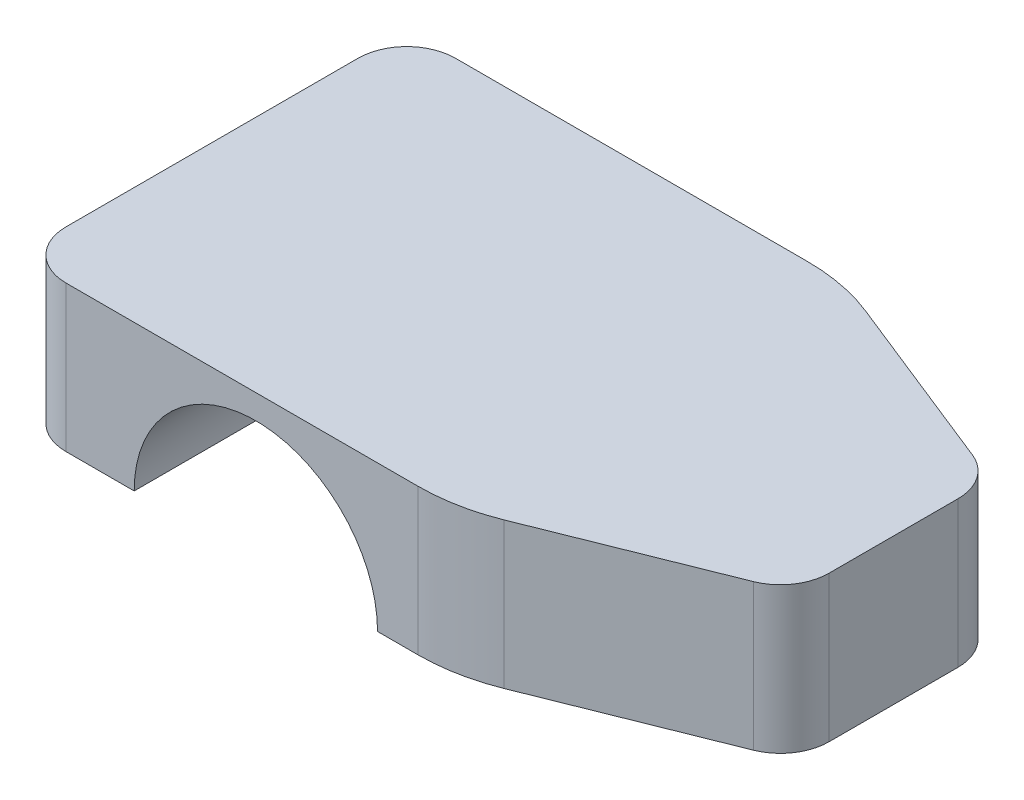
from build123d import *

# Parameters (mm, degrees)
BOSS_EXTRUDE1_DEPTH     = 15
CUT_EXTRUDE1_DEPTH      = 61.415229868
CUT_EXTRUDE1_DEPTH_BACK = 61.415229868
SKETCH2_R               = 12.5
FILLET2_R               = 5
FILLET3_R               = 20


with BuildPart() as part:
    # Sketch1 → Boss-Extrude1 (new body)
    with BuildSketch(Plane(origin=(0, 0, 0), x_dir=(1, 0, 0), z_dir=(0, 1, 0))):
        Polygon((-10, 20), (15, 10), (15, -10), (-10, -20), (-55, -20), (-55, 20), align=None)
    extrude(amount=BOSS_EXTRUDE1_DEPTH)

    # Sketch2 → Cut-Extrude1 (cut, two sides: drawn at the far end of the back side and taken through both)
    with BuildSketch(Plane.XY.offset(-CUT_EXTRUDE1_DEPTH_BACK)):
        with Locations((-30.5, 0)):
            Circle(SKETCH2_R)
    extrude(amount=CUT_EXTRUDE1_DEPTH + CUT_EXTRUDE1_DEPTH_BACK, mode=Mode.SUBTRACT)

    # Fillet2
    fillet2_edges = [part.edges().sort_by_distance(p)[0] for p in [
        (-55, 7.5, 20),
        (-55, 7.5, -20),
        (15, 7.5, -10),
        (15, 7.5, 10),
    ]]
    fillet(fillet2_edges, radius=FILLET2_R)

    # Fillet3
    fillet3_edges = [part.edges().sort_by_distance(p)[0] for p in [
        (-10, 7.5, 20),
        (-10, 7.5, -20),
    ]]
    fillet(fillet3_edges, radius=FILLET3_R)


solid = part.part
